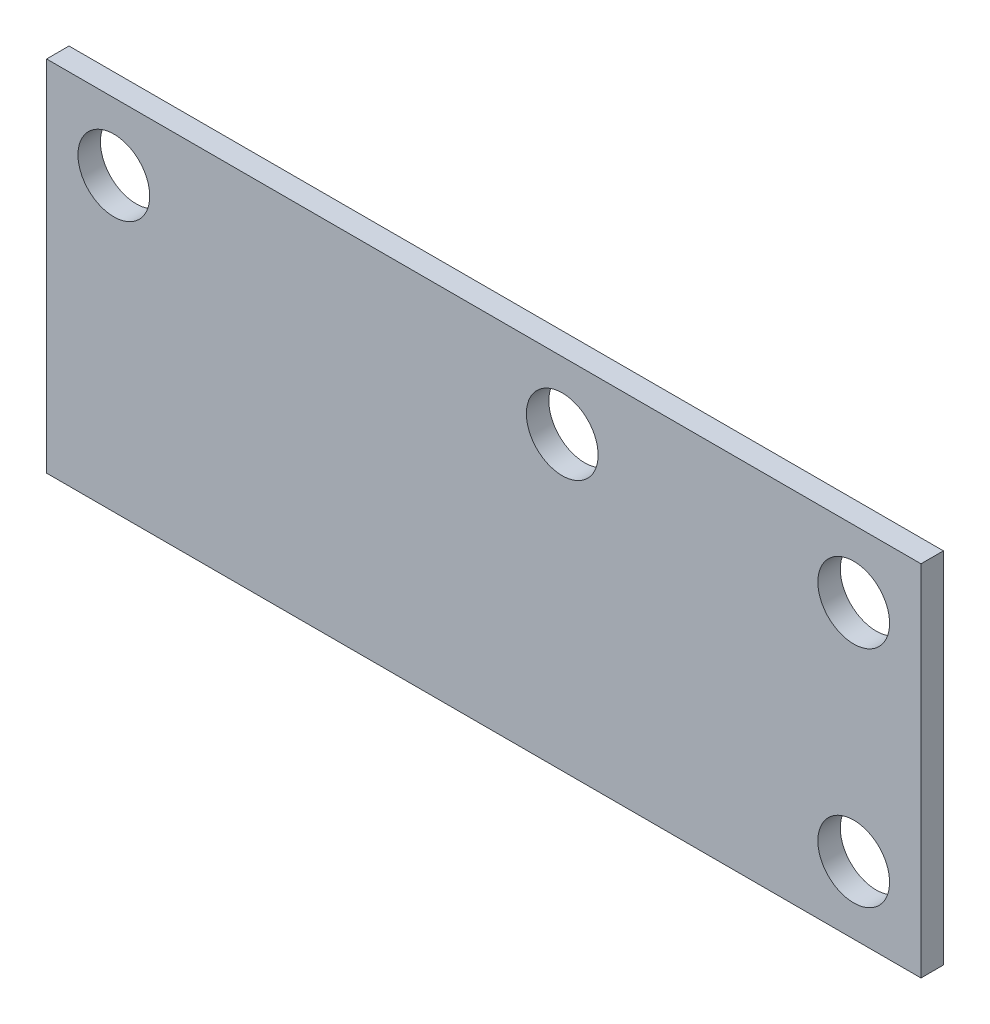
from build123d import *

# Parameters (mm, degrees)
ESQUISSE1_W             = 39
ESQUISSE1_H             = 16
BOSS_EXTRU_1_DEPTH      = 1
ESQUISSE2_R             = 1.6
ENL_V_MAT_EXTRU_1_DEPTH = 1


with BuildPart() as part:
    # Esquisse1 → Boss.-Extru.1 (new body)
    with BuildSketch(Plane.XY):
        with Locations((19.5, 8)):
            Rectangle(ESQUISSE1_W, ESQUISSE1_H)
    extrude(amount=BOSS_EXTRU_1_DEPTH)

    # Esquisse2 → Enlèv. mat.-Extru.1 (cut)
    with BuildSketch(Plane(origin=(0, 0, 0), x_dir=(-1, 0, 0), z_dir=(0, 0, -1))):
        with Locations((-36, 13)):
            Circle(ESQUISSE2_R)
        with Locations((-36, 3)):
            Circle(ESQUISSE2_R)
        with Locations((-23, 13)):
            Circle(ESQUISSE2_R)
        with Locations((-3, 13)):
            Circle(ESQUISSE2_R)
    extrude(amount=-ENL_V_MAT_EXTRU_1_DEPTH, mode=Mode.SUBTRACT)


solid = part.part
